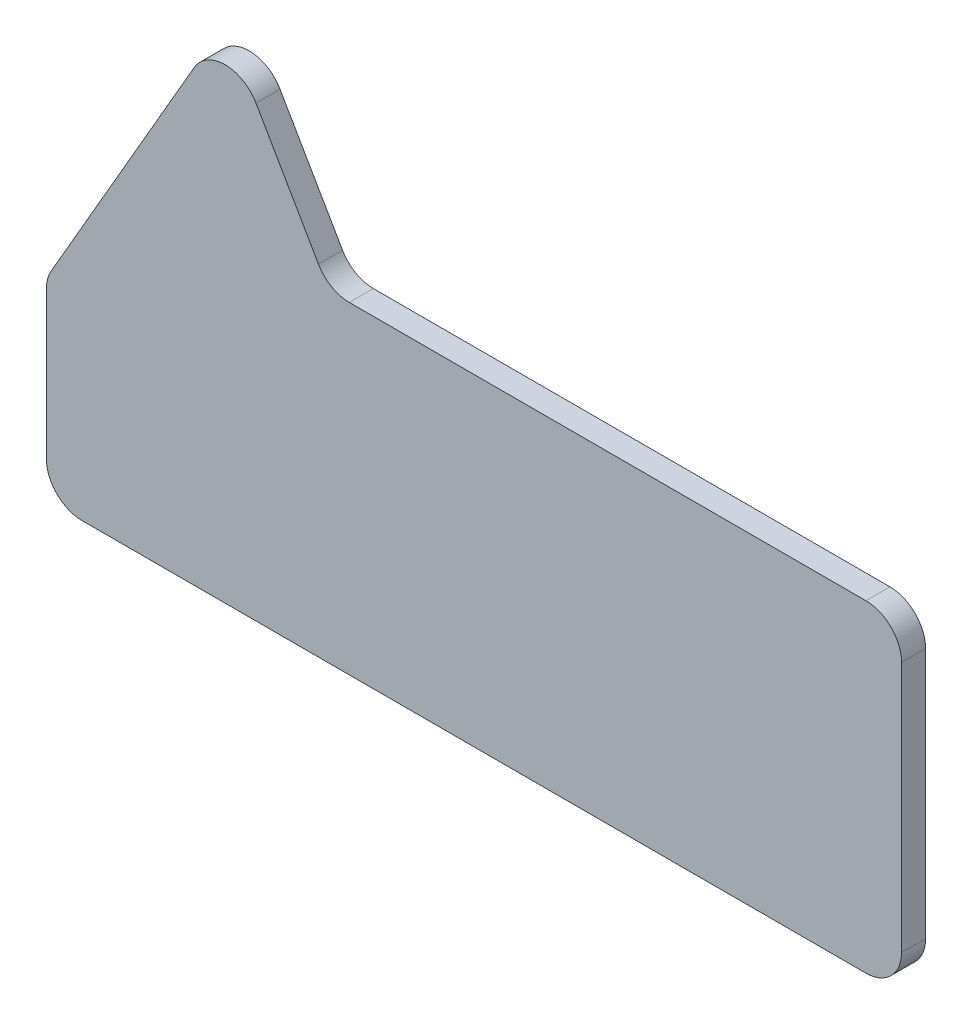
from build123d import *

# Parameters (mm, degrees)
BOSS_EXTRUDE1_DEPTH = 1.35


with BuildPart() as part:
    # Sketch1 → Boss-Extrude1 (new body)
    with BuildSketch(Plane.XY):
        with BuildLine():
            Line((-14.252076709, 14.573110922), (-22.282203728, 0.664522934))
            ThreePointArc((-22.282203728, 0.664522934), (-22.482004573, 0.182161024), (-22.550152921, -0.335477066))
            Line((-22.550152921, -0.335477066), (-22.550152921, -8.596290345))
            ThreePointArc((-22.550152921, -8.596290345), (-21.964366483, -10.010503907), (-20.550152921, -10.596290345))
            Line((-20.550152921, -10.596290345), (23.43867723, -10.596290345))
            ThreePointArc((23.43867723, -10.596290345), (24.852890793, -10.010503907), (25.43867723, -8.596290345))
            Line((25.43867723, -8.596290345), (25.43867723, 5.503709655))
            ThreePointArc((25.43867723, 5.503709655), (24.852890793, 6.917923217), (23.43867723, 7.503709655))
            Line((23.43867723, 7.503709655), (-5.551753831, 7.503709655))
            ThreePointArc((-5.551753831, 7.503709655), (-6.551753831, 7.771658847), (-7.283804639, 8.503709655))
            Line((-7.283804639, 8.503709655), (-10.787975094, 14.573110922))
            ThreePointArc((-10.787975094, 14.573110922), (-12.520025902, 15.573110922), (-14.252076709, 14.573110922))
        make_face()
    extrude(amount=BOSS_EXTRUDE1_DEPTH)


solid = part.part
